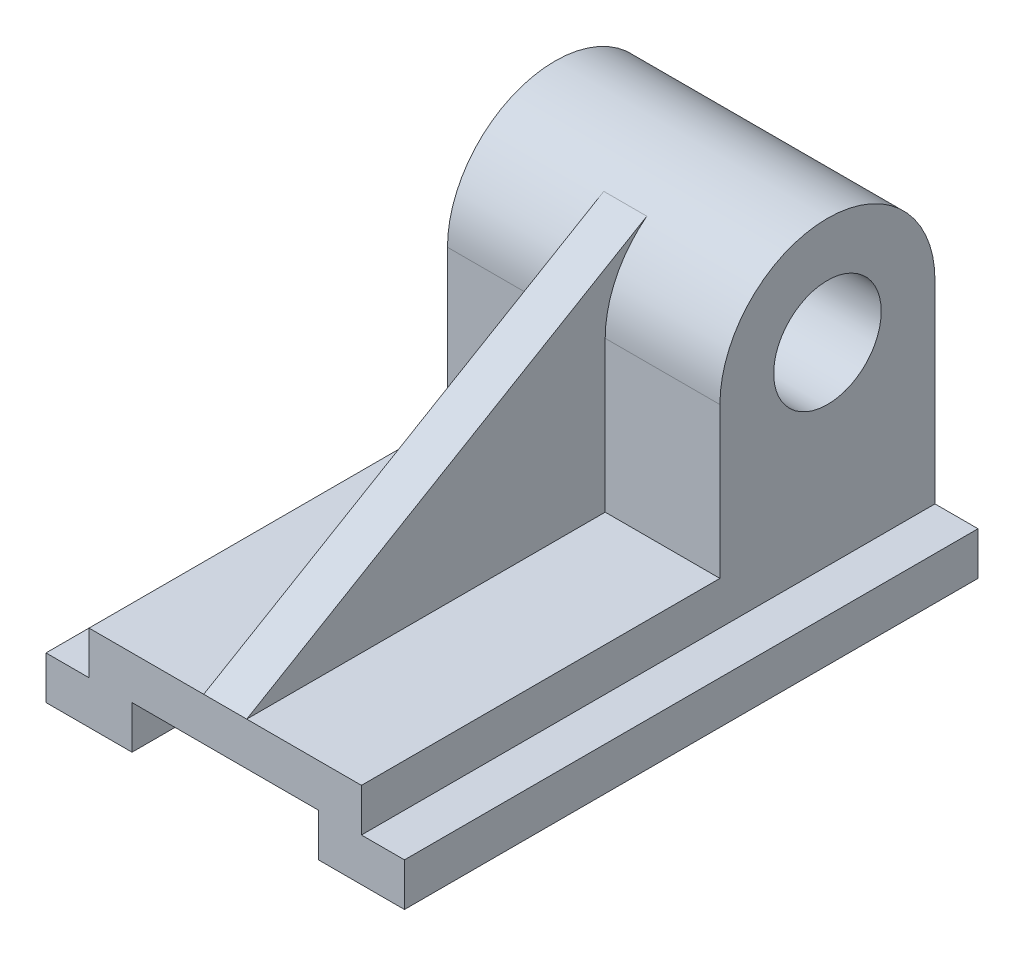
from build123d import *

# Parameters (mm, degrees)
BOSS_EXTRUDE1_DEPTH = 800
SKETCH2_R           = 150
BOSS_EXTRUDE5_DEPTH = 760
RIB1_REACH          = 1305.84
SKETCH4_WALL_W      = 3904.804378638
SKETCH4_WALL_H      = 120


with BuildPart() as part:
    # Sketch1 → Boss-Extrude1 (new, symmetric)
    with BuildSketch(Plane.XY):
        Polygon((380, 60), (260, 60), (260, -60), (500, -60), (500, 60), align=None)
        Polygon((-380, 180), (-380, 60), (-260, 60), (260, 60), (380, 60), (380, 180), align=None)
        Polygon((-260, 60), (-380, 60), (-500, 60), (-500, -60), (-260, -60), align=None)
    extrude(amount=BOSS_EXTRUDE1_DEPTH, both=True)

    # Sketch2 → Boss-Extrude5 (add)
    with BuildSketch(Plane(origin=(380, 0, 0), x_dir=(0, 0, -1), z_dir=(1, 0, 0))):
        with BuildLine():
            Line((800, 180), (800, 600))
            ThreePointArc((800, 600), (500, 900), (200, 600))
            Line((200, 600), (200, 180))
            Line((200, 180), (800, 180))
        make_face()
        with Locations((500, 600)):
            Circle(SKETCH2_R, mode=Mode.SUBTRACT)
    extrude(amount=-BOSS_EXTRUDE5_DEPTH)

    # Sketch4 wall → Rib1 (add, up to next)
    with BuildSketch(Plane(origin=(0, 508.510499954, 241.952495347), x_dir=(0, 0.507303776233, -0.861767299576), z_dir=(0, 0.861767299576, 0.507303776233)), mode=Mode.PRIVATE) as rib1_sk1:
        Rectangle(SKETCH4_WALL_W, SKETCH4_WALL_H)
    rib1_tool1 = extrude(rib1_sk1.sketch, amount=-RIB1_REACH, mode=Mode.PRIVATE) - part.part
    add(rib1_tool1.solids().sort_by_distance((0, 508.510499954, 241.952495347))[0])


solid = part.part
